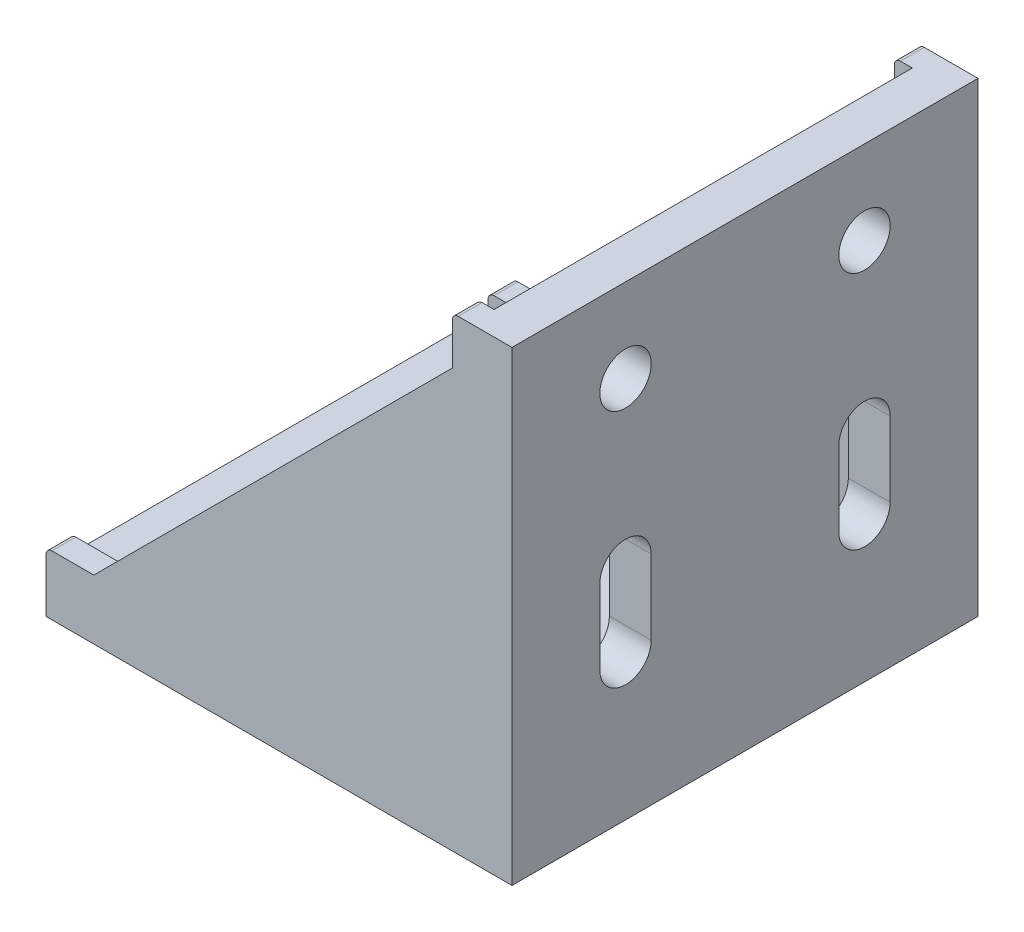
from build123d import *

# Parameters (mm, degrees)
EXTRUDE_1_DEPTH     = 78
SKETCH_2_W          = 76.862745098
SKETCH_2_H          = 79.911669522
CUT_EXTRUDE_1_DEPTH = 35
FILLET_1_R          = 1
SKETCH_3_R          = 4.3
CUT_EXTRUDE_2_DEPTH = 35
SKETCH_4_R          = 4.3
CUT_EXTRUDE_3_DEPTH = 35


with BuildPart() as part:
    # 草图1 → 凸台-拉伸1 (new body)
    with BuildSketch(Plane.XY):
        Polygon((0, 0), (-78, 0), (-78, 10), (-70, 10), (-10, 70), (-10, 78), (0, 78), align=None)
    extrude(amount=EXTRUDE_1_DEPTH)

    # 草图2 → 切除-拉伸1 (cut, symmetric)
    with BuildSketch(Plane.XY.offset(39)):
        with Locations((-45.431372549, 46.955834761)):
            Rectangle(SKETCH_2_W, SKETCH_2_H)
    extrude(amount=CUT_EXTRUDE_1_DEPTH, both=True, mode=Mode.SUBTRACT)

    # 圆角1
    fillet_1_edges = [part.edges().sort_by_distance(p)[0] for p in [
        (-78, 10, 76),
        (-10, 78, 76),
        (-78, 10, 2),
        (-10, 78, 2),
    ]]
    fillet(fillet_1_edges, radius=FILLET_1_R)

    # 草图3 → 切除-拉伸2 (cut, symmetric)
    with BuildSketch(Plane(origin=(0, 0, 0), x_dir=(0, 0, -1), z_dir=(1, 0, 0))):
        with Locations(Location((-19, 64, 0), (0, 0, 90))):
            Circle(SKETCH_3_R)
        with Locations(Location((-59, 64, 0), (0, 0, 90))):
            Circle(SKETCH_3_R)
        with BuildLine():
            Line((-14.7, 36.4), (-14.7, 23.9))
            ThreePointArc((-14.7, 23.9), (-19, 19.6), (-23.3, 23.9))
            Line((-23.3, 23.9), (-23.3, 36.4))
            ThreePointArc((-23.3, 36.4), (-19, 40.7), (-14.7, 36.4))
        make_face()
        with BuildLine():
            Line((-54.7, 36.4), (-54.7, 23.9))
            ThreePointArc((-54.7, 23.9), (-59, 19.6), (-63.3, 23.9))
            Line((-63.3, 23.9), (-63.3, 36.4))
            ThreePointArc((-63.3, 36.4), (-59, 40.7), (-54.7, 36.4))
        make_face()
    extrude(amount=CUT_EXTRUDE_2_DEPTH, both=True, mode=Mode.SUBTRACT)

    # 草图4 → 切除-拉伸3 (cut, symmetric)
    with BuildSketch(Plane.XZ):
        with Locations(Location((-64, 59, 0), (0, 0, 270))):
            Circle(SKETCH_4_R)
        with Locations(Location((-64, 19, 0), (0, 0, 270))):
            Circle(SKETCH_4_R)
        with BuildLine():
            Line((-36.4, 63.3), (-23.9, 63.3))
            ThreePointArc((-23.9, 63.3), (-19.6, 59), (-23.9, 54.7))
            Line((-23.9, 54.7), (-36.4, 54.7))
            ThreePointArc((-36.4, 54.7), (-40.7, 59), (-36.4, 63.3))
        make_face()
        with BuildLine():
            Line((-36.4, 23.3), (-23.9, 23.3))
            ThreePointArc((-23.9, 23.3), (-19.6, 19), (-23.9, 14.7))
            Line((-23.9, 14.7), (-36.4, 14.7))
            ThreePointArc((-36.4, 14.7), (-40.7, 19), (-36.4, 23.3))
        make_face()
    extrude(amount=CUT_EXTRUDE_3_DEPTH, both=True, mode=Mode.SUBTRACT)


solid = part.part
